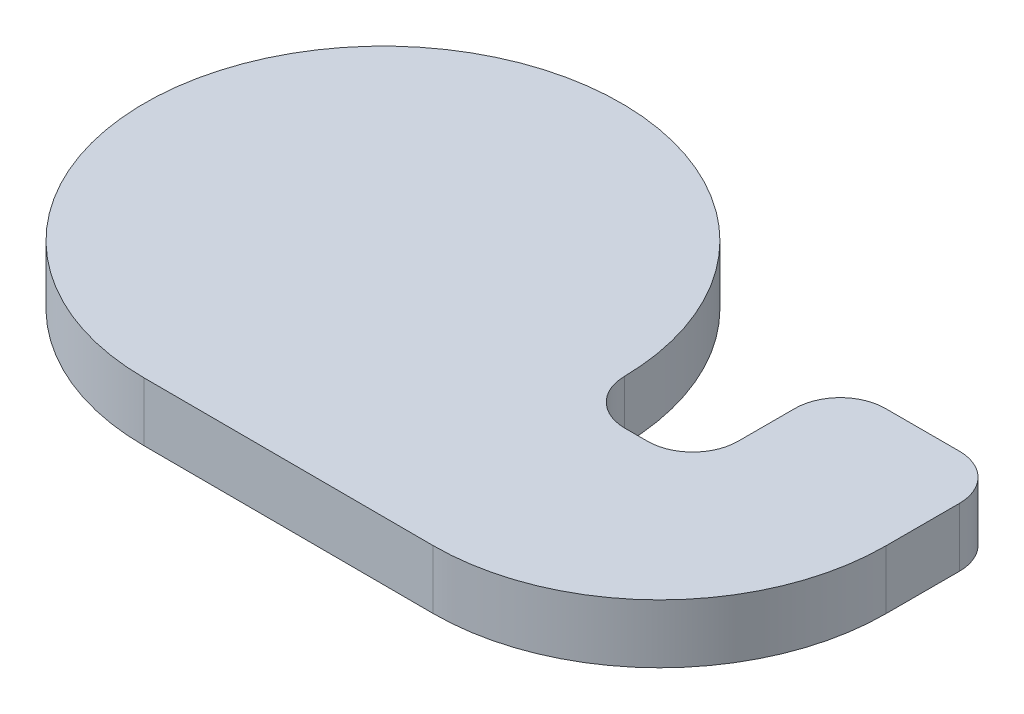
from build123d import *

# Parameters (mm, degrees)
BOSS_EXTRUDE1_START = -0.2
BOSS_EXTRUDE1_DEPTH = 2.6


with BuildPart() as part:
    # Sketch3 → Boss-Extrude1 (new body)
    with BuildSketch(Plane(origin=(0, 0, 0), x_dir=(1, 0, 0), z_dir=(0, 1, 0)).offset(BOSS_EXTRUDE1_START)):
        with BuildLine():
            Line((24.837294245, -10.53319149), (37.637975917, -10.56578536))
            ThreePointArc((37.637975917, -10.56578536), (44.725498152, -7.645882227), (47.663438439, -0.565817777))
            Line((47.663438439, -0.565817777), (47.663438439, 2.68092068))
            ThreePointArc((47.663438439, 2.68092068), (47.077652002, 4.095134243), (45.663438439, 4.68092068))
            Line((45.663438439, 4.68092068), (42.393317115, 4.68092068))
            ThreePointArc((42.393317115, 4.68092068), (40.979103553, 4.095134243), (40.393317115, 2.68092068))
            Line((40.393317115, 2.68092068), (40.393317115, 0.166619972))
            ThreePointArc((40.393317115, 0.166619972), (39.807530678, -1.24759359), (38.393317115, -1.833380028))
            Line((38.393317115, -1.833380028), (37.396232536, -1.833380028))
            ThreePointArc((37.396232536, -1.833380028), (35.991450888, -1.256963015), (35.396409281, 0.14003145))
            ThreePointArc((35.396409281, 0.14003145), (17.376079319, 7.407980257), (24.837294245, -10.53319149))
        make_face()
    extrude(amount=-BOSS_EXTRUDE1_DEPTH)


solid = part.part
